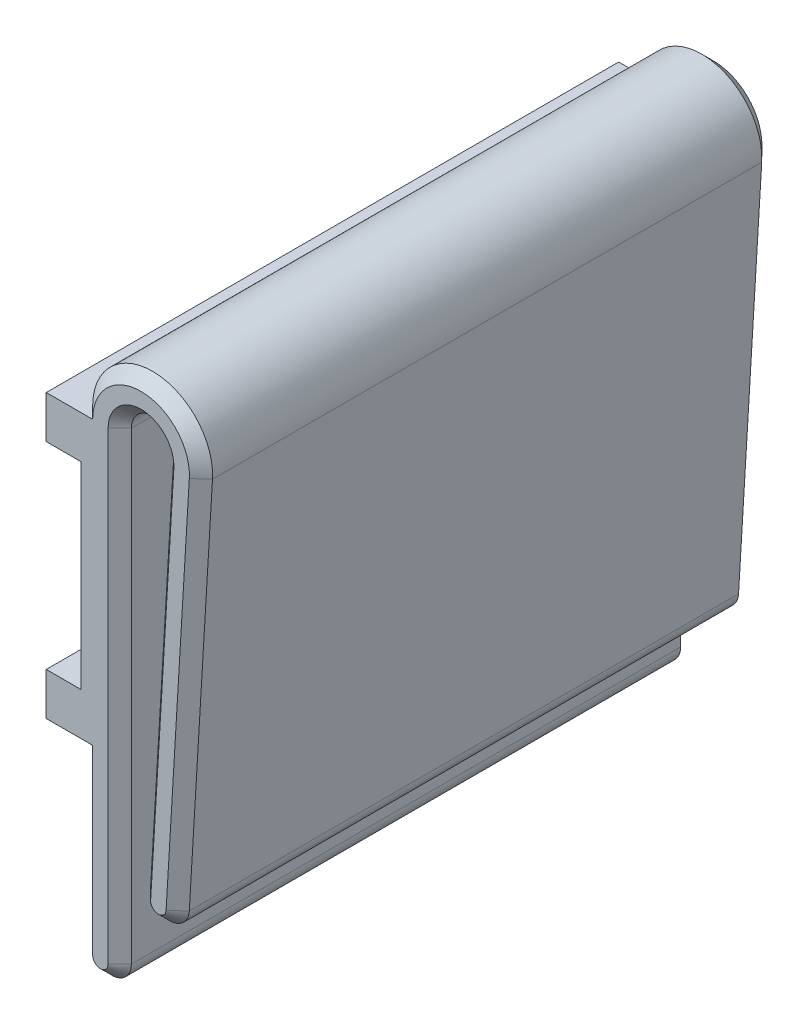
from build123d import *

# Parameters (mm, degrees)
SKETCH1_W           = 0.9
SKETCH1_H           = 1.1
BOSS_EXTRUDE1_DEPTH = 14.8
CHAMFER1_SIZE       = 0.3


with BuildPart() as part:
    # Sketch1 → Boss-Extrude1 (new body)
    with BuildSketch(Plane.XY):
        with BuildLine():
            Line((1.1, -0.033079582), (0.5, -10))
            ThreePointArc((0.5, -10), (0.969051295, -10.529141647), (1.498192942, -10.060090353))
            Line((1.498192942, -10.060090353), (2.098192942, -0.093169935))
            ThreePointArc((2.098192942, -0.093169935), (0.597103418, 1.549796772), (-1, 0))
            Line((-1, 0), (-1, -12))
            ThreePointArc((-1, -12), (-0.5, -12.5), (0, -12))
            Line((0, -12), (0, 0))
            ThreePointArc((0, 0), (0.567044659, 0.550248639), (1.1, -0.033079582))
        make_face()
        with Locations((-1.45, -0.55)):
            Rectangle(SKETCH1_W, SKETCH1_H)
        with Locations((-1.45, -6.75)):
            Rectangle(SKETCH1_W, SKETCH1_H)
    extrude(amount=BOSS_EXTRUDE1_DEPTH)

    # Chamfer1
    chamfer1_edges = [part.edges().sort_by_distance(p)[0] for p in [
        (0.969051295, -10.529141647, 14.8),
        (1.798192942, -5.076630144, 14.8),
        (0.567044659, 0.550248639, 0),
        (0, -6, 0),
        (-0.5, -12.5, 0),
        (-1, -9.65, 0),
        (0.597103418, 1.549796772, 14.8),
        (0.597103418, 1.549796772, 0),
        (1.798192942, -5.076630144, 0),
        (0.969051295, -10.529141647, 0),
        (0.8, -5.016539791, 0),
        (0.8, -5.016539791, 14.8),
        (-1, -9.65, 14.8),
        (-0.5, -12.5, 14.8),
        (0, -6, 14.8),
        (0.567044659, 0.550248639, 14.8),
    ]]
    chamfer(chamfer1_edges, length=CHAMFER1_SIZE)


solid = part.part
